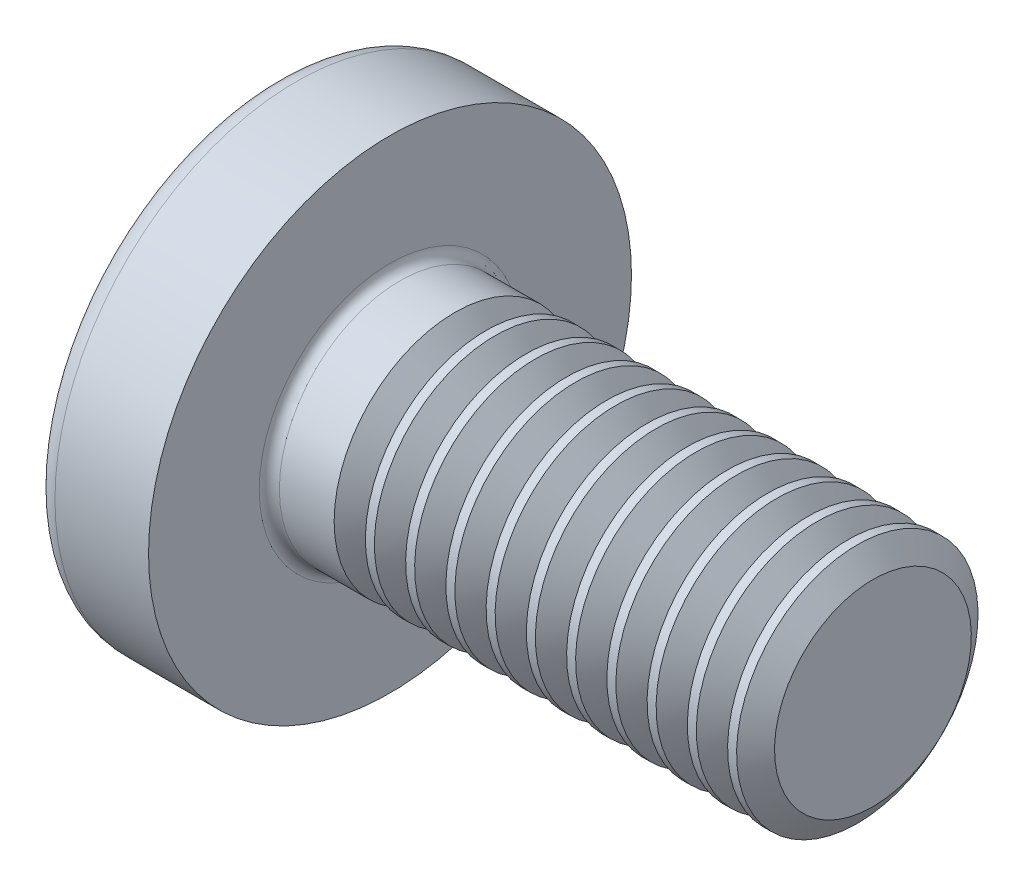
from build123d import *

# Parameters (mm, degrees)
FILLET1_R       = 0.25
RECPAT_COUNT    = 2
RECPAT_ANGLE    = 90
THDSCHPAT_COUNT = 11
THDSCHPAT_PITCH = 1


with BuildPart() as part:
    # BodySke → Base-Revolve (revolve)
    with BuildSketch(Plane.XY, mode=Mode.PRIVATE) as base_revolve_sk:
        with BuildLine():
            Line((4.6, 3), (4.6, 6))
            Line((4.6, 6), (2.274716834, 6))
            ThreePointArc((2.274716834, 6), (2.026424569, 5.939532013), (1.833738725, 5.77167019))
            ThreePointArc((1.833738725, 5.77167019), (0.469454036, 3.027985077), (0, 0))
            Line((0, 0), (16.6, 0))
            Line((16.6, 0), (16.6, 3))
            Line((16.6, 3), (4.6, 3))
        make_face()
    revolve(base_revolve_sk.sketch.rotate(Axis((2.274716834, 0, 0), (1, 0, 0)), 90), axis=Axis((2.274716834, 0, 0), (1, 0, 0)))

    # Fillet1
    fillet1_edges = [part.edges().sort_by_distance(p)[0] for p in [
        (4.6, 0, -3),
    ]]
    fillet(fillet1_edges, radius=FILLET1_R)

    # Sketch3 → Recess section 0
    with BuildSketch(Plane(origin=(0, 0, 0), x_dir=(0, 0, -1), z_dir=(1, 0, 0))):
        with BuildLine():
            Line((0.71, -3.35), (-0.71, -3.35))
            Line((-0.71, -3.35), (-0.71, 3.35))
            Line((-0.71, 3.35), (0.71, 3.35))
            Line((0.71, 3.35), (0.71, -3.35))
        make_face()
    # Sketch4 → Recess section 1
    with BuildSketch(Plane(origin=(3.46, 0, 0), x_dir=(0, 0, -1), z_dir=(1, 0, 0))):
        with BuildLine():
            Line((0.71, -1.624907696), (-0.71, -1.624907696))
            Line((-0.71, -1.624907696), (-0.71, 1.624907696))
            Line((-0.71, 1.624907696), (0.71, 1.624907696))
            Line((0.71, 1.624907696), (0.71, -1.624907696))
        make_face()
    recess = loft(mode=Mode.SUBTRACT)

    # RecPat: Recess ×2 about axis
    recpat_axis = Axis((0, 0, 0), (1, 0, 0))
    for i in range(1, RECPAT_COUNT):
        add(recess.rotate(recpat_axis, i * RECPAT_ANGLE / (RECPAT_COUNT - 1)), mode=Mode.SUBTRACT)

    # RecCorSke → RecessCore (revolve, cut)
    with BuildSketch(Plane.XY, mode=Mode.PRIVATE) as recesscore_sk:
        Polygon((0, 0), (0, 1.522446769), (3.46, 1.2805), (3.876059671, 0), align=None)
    revolve(recesscore_sk.sketch.rotate(Axis((-3.175, 0, 0), (1, 0, 0)), 12.930792046), axis=Axis((-3.175, 0, 0), (1, 0, 0)), mode=Mode.SUBTRACT)

    # ThdSchSke → ThreadSchematic (revolve, cut)
    with BuildSketch(Plane.XY, mode=Mode.PRIVATE) as threadschematic_sk:
        Polygon((6.6, -2.4455), (6.21173492, -3), (6.21173492, -3.75), (6.98826508, -3.75), (6.98826508, -3), align=None)
    threadschematic = revolve(threadschematic_sk.sketch.rotate(Axis((-3.175, 0, 0), (1, 0, 0)), 270), axis=Axis((-3.175, 0, 0), (1, 0, 0)), mode=Mode.SUBTRACT)

    # ThdSchPat: ThreadSchematic ×11
    with Locations(*[(i * THDSCHPAT_PITCH, 0, 0) for i in range(1, THDSCHPAT_COUNT)]):
        add(threadschematic, mode=Mode.SUBTRACT)


solid = part.part
